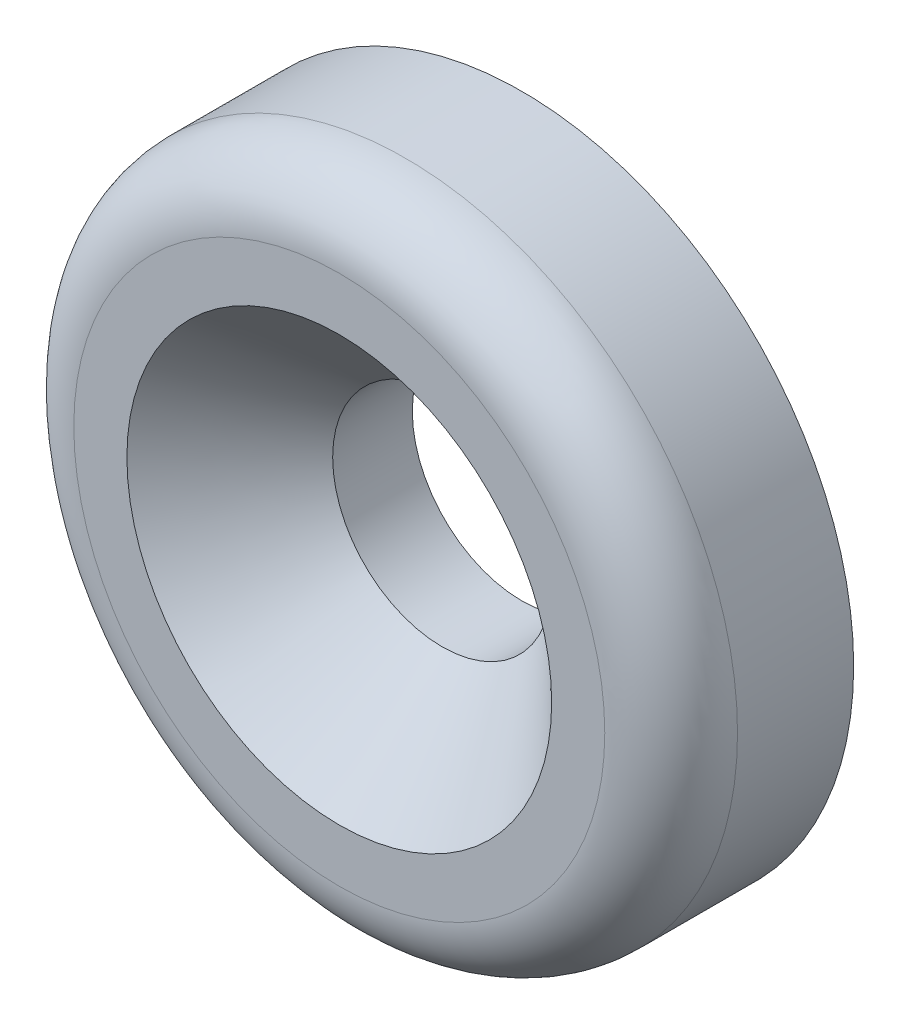
from build123d import *

# Parameters (mm, degrees)
SKETCH1_R           = 5
SKETCH1_R_2         = 1.65
BOSS_EXTRUDE1_DEPTH = 2.75
CHAMFER2_SIZE       = 1.55
FILLET1_R           = 1


with BuildPart() as part:
    # Sketch1 → Boss-Extrude1 (new body)
    with BuildSketch(Plane(origin=(0, 0, 0), x_dir=(0, 1, 0), z_dir=(0, 0, 1))):
        with Locations(Location((0, 0, 0), (0, 0, 270))):
            Circle(SKETCH1_R)
        with Locations(Location((0, 0, 0), (0, 0, 270))):
            Circle(SKETCH1_R_2, mode=Mode.SUBTRACT)
    extrude(amount=BOSS_EXTRUDE1_DEPTH)

    # Chamfer2
    chamfer2_edges = [part.edges().sort_by_distance(p)[0] for p in [
        (-1.65, 0, 2.75),
    ]]
    chamfer(chamfer2_edges, length=CHAMFER2_SIZE)

    # Fillet1
    fillet1_edges = [part.edges().sort_by_distance(p)[0] for p in [
        (-5, 0, 2.75),
    ]]
    fillet(fillet1_edges, radius=FILLET1_R)


solid = part.part
